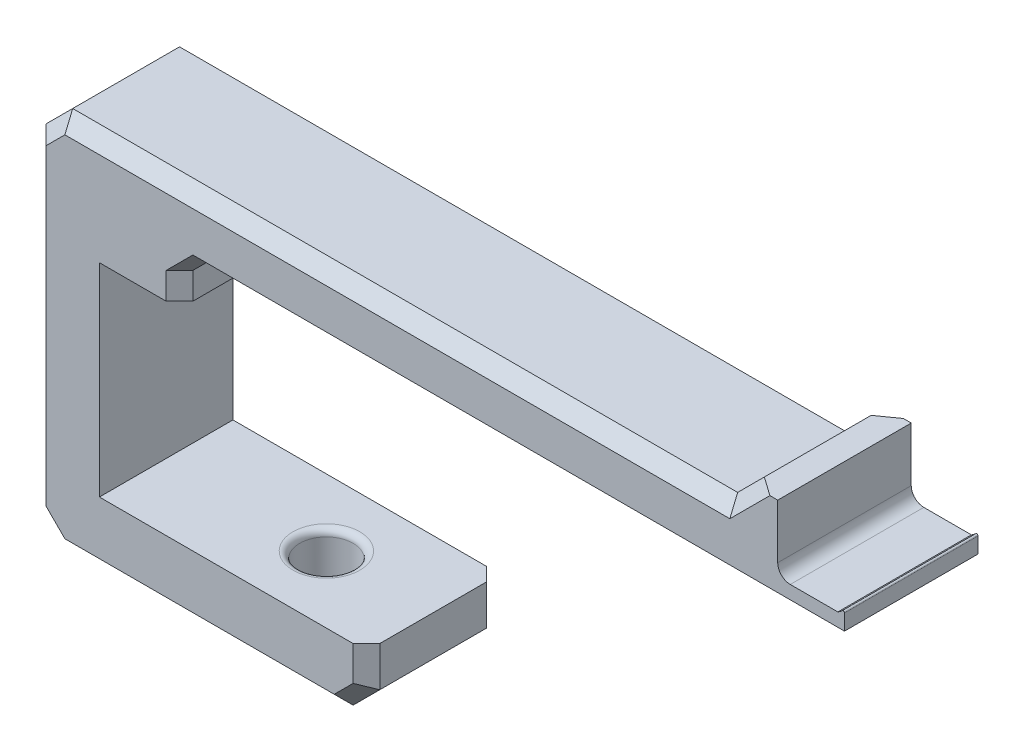
from build123d import *

# Parameters (mm, degrees)
RESSALTO_EXTRUS_O1_DEPTH = 10
ESBO_O3_R                = 2
CORTE_EXTRUS_O1_DEPTH    = 15
CHANFRO1_SIZE            = 1.6
FILETE1_R                = 0.5
FILETE2_R                = 0.94
RESSALTO_EXTRUS_O3_DEPTH = 10
CHANFRO5_SIZE            = 2
CHANFRO4_SIZE            = 1


with BuildPart() as part:
    # Esboço1 → Ressalto-extrusão1 (new body)
    with BuildSketch(Plane.XY):
        with BuildLine():
            Line((57, 14.25), (7.2, 14.25))
            Line((7.2, 14.25), (7.2, 11.25))
            Line((7.2, 11.25), (1.2, 11.25))
            Line((1.2, 11.25), (1.2, -3.95))
            Line((1.2, -3.95), (21.2, -3.95))
            Line((21.2, -3.95), (21.2, -8.95))
            Line((21.2, -8.95), (-3.8, -8.95))
            Line((-3.8, -8.95), (-3.8, 19.25))
            Line((-3.8, 19.25), (52, 19.25))
            Line((52, 19.25), (52, 16.25))
            Line((52, 16.25), (56.504380809, 16.25))
            ThreePointArc((56.504380809, 16.25), (56.67525574, 16.362291088), (56.829148206, 16.496918869))
            ThreePointArc((56.829148206, 16.496918869), (56.938176044, 16.51877572), (57, 16.426349589))
            Line((57, 16.426349589), (57, 16.25))
            Line((57, 16.25), (57, 14.25))
        make_face()
    extrude(amount=RESSALTO_EXTRUS_O1_DEPTH)

    # Esboço3 → Corte-extrusão1 (cut)
    with BuildSketch(Plane.XZ.offset(8.95)):
        with Locations(Location((13.2, 5, 0), (0, 0, 270))):
            Circle(ESBO_O3_R)
    extrude(amount=-CORTE_EXTRUS_O1_DEPTH, mode=Mode.SUBTRACT)

    # Chanfro1
    chanfro1_edges = [part.edges().sort_by_distance(p)[0] for p in [
        (13.2, -8.95, 7),
    ]]
    chamfer(chanfro1_edges, length=CHANFRO1_SIZE)

    # Filete1
    filete1_edges = [part.edges().sort_by_distance(p)[0] for p in [
        (13.2, -3.95, 7),
    ]]
    fillet(filete1_edges, radius=FILETE1_R)

    # Filete2
    filete2_edges = [part.edges().sort_by_distance(p)[0] for p in [
        (52, 16.25, 5),
    ]]
    fillet(filete2_edges, radius=FILETE2_R)

    # Esboço5 → Ressalto-extrusão3 (add)
    with BuildSketch(Plane.XY.offset(10)):
        Polygon((52, 19.25), (52, 21.25), (50, 21.25), (48, 19.25), align=None)
    extrude(amount=-RESSALTO_EXTRUS_O3_DEPTH)

    # Chanfro5
    chanfro5_edges = [part.edges().sort_by_distance(p)[0] for p in [
        (21.2, -8.95, 5),
        (-3.8, -8.95, 5),
        (-3.8, 19.25, 5),
    ]]
    chamfer(chanfro5_edges, length=CHANFRO5_SIZE)

    # Chanfro4
    chanfro4_edges = [part.edges().sort_by_distance(p)[0] for p in [
        (32.1, 14.25, 0),
        (7.2, 12.75, 0),
        (57, 14.25, 5),
        (7.2, 14.25, 5),
        (7.2, 12.75, 10),
        (23.1, 19.25, 0),
        (23.1, 19.25, 10),
        (49, 20.25, 10),
        (49, 20.25, 0),
        (8.7, -8.95, 0),
        (8.7, -8.95, 10),
        (21.2, -5.45, 0),
        (-3.8, 5.15, 0),
        (-2.8, 18.25, 0),
        (20.2, -7.95, 0),
        (-2.8, -7.95, 0),
        (-3.8, 5.15, 10),
        (21.2, -5.45, 10),
        (-2.8, 18.25, 10),
        (20.2, -7.95, 10),
        (-2.8, -7.95, 10),
        (32.1, 14.25, 10),
    ]]
    chamfer(chanfro4_edges, length=CHANFRO4_SIZE)


solid = part.part
